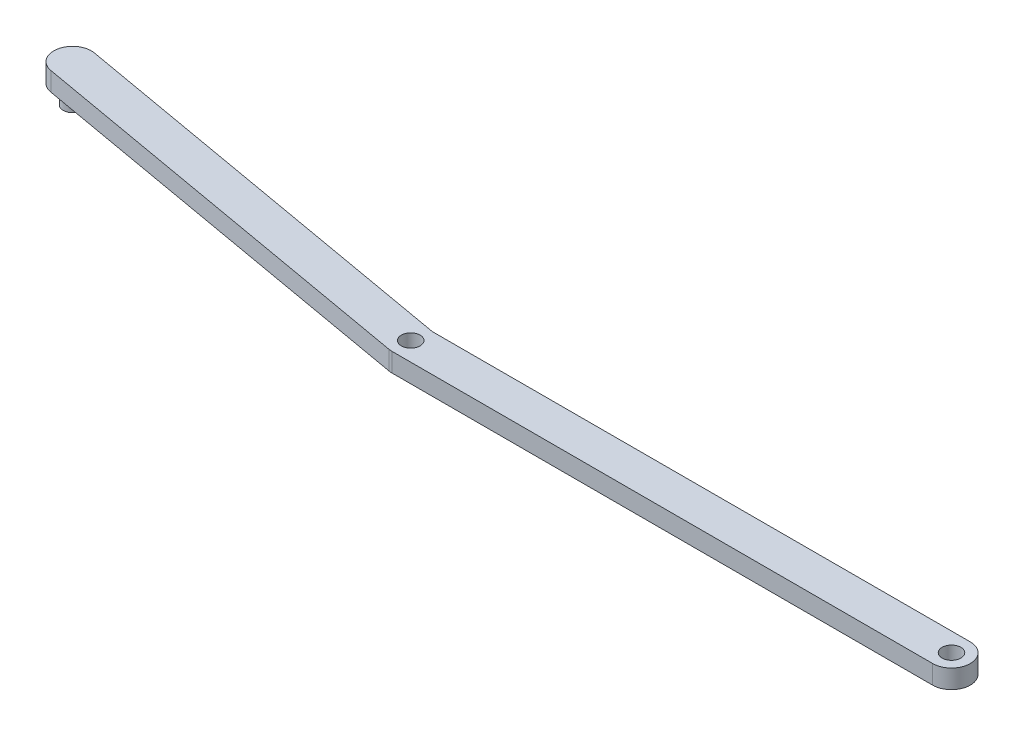
from build123d import *

# Parameters (mm, degrees)
SKETCH1_R                = 5
BOSS_EXTRUDE1_DEPTH      = 5
BOSS_EXTRUDE2_DEPTH      = 5
BOSS_EXTRUDE2_DEPTH_BACK = 15
SKETCH2_R                = 5


with BuildPart() as part:
    # Sketch1 → Boss-Extrude1 (new, symmetric)
    with BuildSketch(Plane(origin=(0, 0, 0), x_dir=(1, 0, 0), z_dir=(0, 1, 0))):
        with BuildLine():
            Line((-216.890839392, 48.397972972), (1.736481777, 9.84807753))
            Line((1.736481777, 9.84807753), (288, 10))
            ThreePointArc((288, 10), (298, 0), (288, -10))
            Line((288, -10), (0, -10))
            ThreePointArc((0, -10), (-0.871557427, -9.961946981), (-1.736481777, -9.84807753))
            Line((-1.736481777, -9.84807753), (-220.363802945, 28.701817912))
            ThreePointArc((-220.363802945, 28.701817912), (-228.475398699, 40.286377219), (-216.890839392, 48.397972972))
        make_face()
        with Locations(Location((-218.627321169, 38.549895442, 0), (0, 0, 270))):
            Circle(SKETCH1_R, mode=Mode.SUBTRACT)
        with Locations(Location((0, 0, 0), (0, 0, 270))):
            Circle(SKETCH1_R, mode=Mode.SUBTRACT)
        with Locations(Location((288, 0, 0), (0, 0, 270))):
            Circle(SKETCH1_R, mode=Mode.SUBTRACT)
    extrude(amount=BOSS_EXTRUDE1_DEPTH, both=True)

    # Sketch2 → Boss-Extrude2 (add, two sides: drawn at the far end of the back side and taken through both)
    with BuildSketch(Plane(origin=(0, 0, 0), x_dir=(1, 0, 0), z_dir=(0, 1, 0)).offset(-BOSS_EXTRUDE2_DEPTH_BACK)):
        with Locations(Location((-218.627321169, 38.549895442, 0), (0, 0, 270))):
            Circle(SKETCH2_R)
    extrude(amount=BOSS_EXTRUDE2_DEPTH + BOSS_EXTRUDE2_DEPTH_BACK)


solid = part.part
